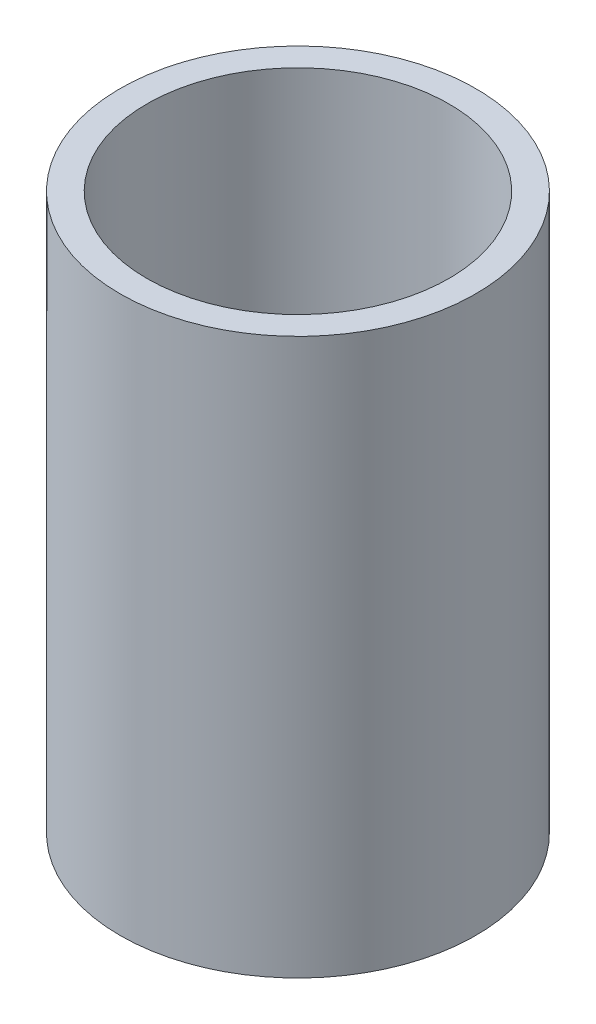
from build123d import *

# Parameters (mm, degrees)
SKETCH_1_R      = 16
SKETCH_1_R_2    = 13.6
EXTRUDE_1_DEPTH = 50


with BuildPart() as part:
    # 草图1 → 凸台-拉伸1 (new body)
    with BuildSketch(Plane(origin=(0, 0, 0), x_dir=(1, 0, 0), z_dir=(0, 1, 0))):
        with Locations(Location((0, 0, 0), (0, 0, 270))):
            Circle(SKETCH_1_R)
        with Locations(Location((0, 0, 0), (0, 0, 270))):
            Circle(SKETCH_1_R_2, mode=Mode.SUBTRACT)
    extrude(amount=EXTRUDE_1_DEPTH)


solid = part.part
